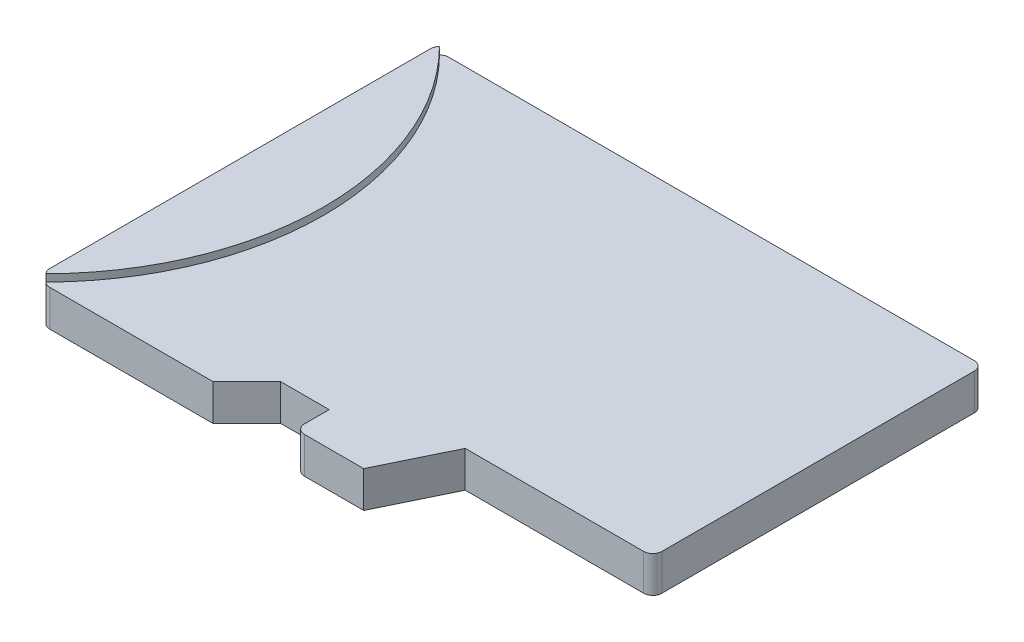
from build123d import *

# Parameters (mm, degrees)
SKETCH1_W           = 15
SKETCH1_H           = 11
BOSS_EXTRUDE1_DEPTH = 1
CUT_EXTRUDE3_DEPTH  = 19.62793601
CUT_EXTRUDE4_DEPTH  = 19.62793601
FILLET3_R           = 0.25
FILLET4_R           = 0.25
SKETCH8_R           = 7.705
BOSS_EXTRUDE2_DEPTH = 0.2
SKETCH12_W          = 14.564245133
SKETCH12_H          = 17.019207238
CUT_EXTRUDE5_DEPTH  = 21.020290333
FILLET5_R           = 0.25


with BuildPart() as part:
    # Sketch1 → Boss-Extrude1 (new body)
    with BuildSketch(Plane(origin=(0, 0, 0), x_dir=(1, 0, 0), z_dir=(0, 1, 0))):
        with Locations((7.5, 5.5)):
            Rectangle(SKETCH1_W, SKETCH1_H)
    extrude(amount=BOSS_EXTRUDE1_DEPTH)

    # Sketch4 → Cut-Extrude3 (cut, through all)
    with BuildSketch(Plane(origin=(0, 1, 0), x_dir=(1, 0, 0), z_dir=(0, 1, 0))):
        Polygon((4.749438202, 0), (5.682709114, 0.933270911), (7.024594257, 0.933270911), (7.024594257, 0), align=None)
    extrude(amount=-CUT_EXTRUDE3_DEPTH, mode=Mode.SUBTRACT)

    # Sketch6 → Cut-Extrude4 (cut, through all)
    with BuildSketch(Plane(origin=(0, 1, 0), x_dir=(1, 0, 0), z_dir=(0, 1, 0))):
        Polygon((8.909238452, 0), (9.826092385, 1.883520599), (15, 1.883520599), (15, 0), align=None)
    extrude(amount=-CUT_EXTRUDE4_DEPTH, mode=Mode.SUBTRACT)

    # Fillet3
    fillet3_edges = [part.edges().sort_by_distance(p)[0] for p in [
        (15, 0.5, -1.883520599),
    ]]
    fillet(fillet3_edges, radius=FILLET3_R)

    # Fillet4
    fillet4_edges = [part.edges().sort_by_distance(p)[0] for p in [
        (7.024594257, 0.5, 0),
    ]]
    fillet(fillet4_edges, radius=FILLET4_R)

    # Sketch8 → Boss-Extrude2 (add)
    with BuildSketch(Plane(origin=(0, 1, 0), x_dir=(1, 0, 0), z_dir=(0, 1, 0))):
        with Locations(Location((-5.396795531, 5.5, 0), (0, 0, 45.538670416))):
            Circle(SKETCH8_R)
    extrude(amount=BOSS_EXTRUDE2_DEPTH)

    # Sketch12 → Cut-Extrude5 (cut, through all)
    with BuildSketch(Plane(origin=(0, 1.2, 0), x_dir=(1, 0, 0), z_dir=(0, 1, 0))):
        with Locations((-7.282122567, 5.49450546)):
            Rectangle(SKETCH12_W, SKETCH12_H)
    extrude(amount=-CUT_EXTRUDE5_DEPTH, mode=Mode.SUBTRACT)

    # Fillet5
    fillet5_edges = [part.edges().sort_by_distance(p)[0] for p in [
        (15, 0.5, -11),
        (0, 0.5, 0),
        (0, 0.5, -11),
    ]]
    fillet(fillet5_edges, radius=FILLET5_R)


solid = part.part
